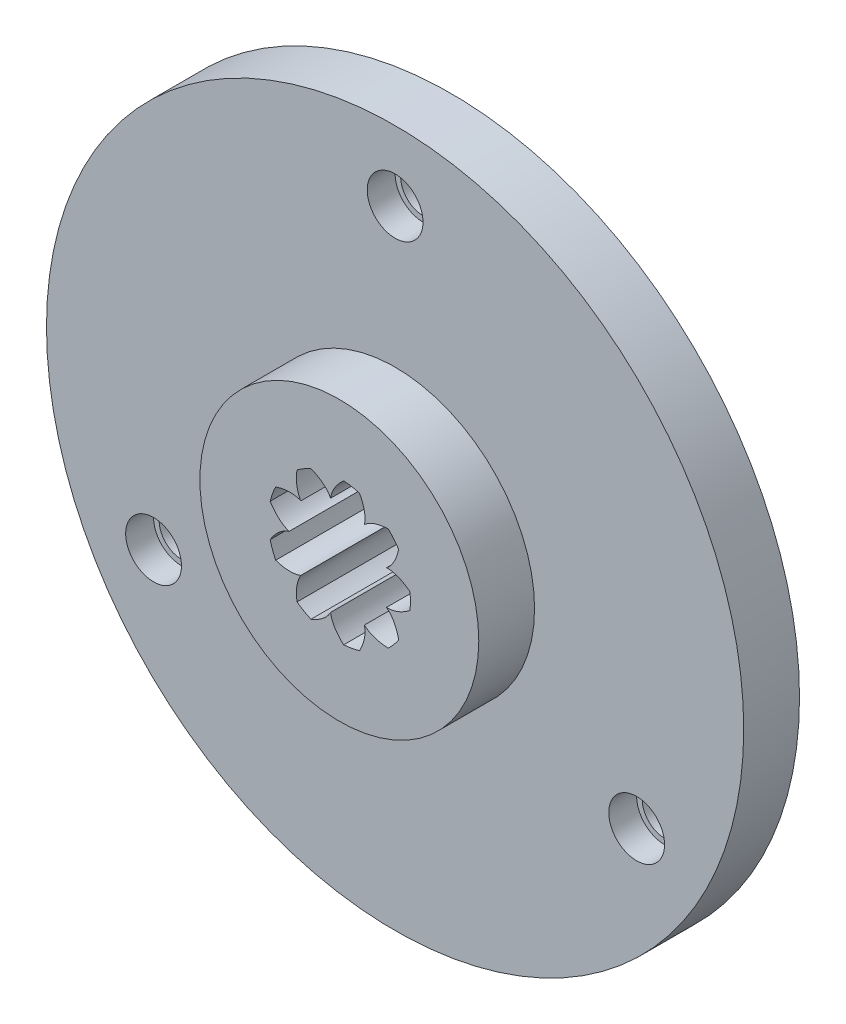
from build123d import *

# Parameters (mm, degrees)
SKETCH_1_R               = 3
SKETCH_1_R_2             = 1.65
EXTRUDE_1_DEPTH          = 4
CUT_EXTRUDE_2_DEPTH      = 6.830951895
PATTERN_CIRCULAR_1_COUNT = 9
SKETCH_2_R               = 5
SKETCH_2_R_2             = 3
EXTRUDE_2_DEPTH          = 4
SKETCH_3_R               = 12.5
SKETCH_3_R_2             = 0.8
SKETCH_3_R_3             = 5
EXTRUDE_4_DEPTH          = 2
CUT_EXTRUDE_START        = 2
SKETCH_3_3_R             = 1
CUT_EXTRUDE_3_DEPTH      = 1


with BuildPart() as part:
    # 草图1 → 凸台-拉伸1 (new body)
    with BuildSketch(Plane.XY):
        Circle(SKETCH_1_R)
        Circle(SKETCH_1_R_2, mode=Mode.SUBTRACT)
    extrude(amount=EXTRUDE_1_DEPTH)

    # 草图1<3> → 切除-拉伸2 (cut, through all)
    with BuildSketch(Plane.XY):
        with BuildLine():
            Line((1.583201231, 0.595370355), (1.54440693, 0.580781573))
            ThreePointArc((1.54440693, 0.580781573), (1.623387112, 0.295151288), (1.65, 0))
            ThreePointArc((1.65, 0), (1.623387112, -0.295151288), (1.54440693, -0.580781573))
            Line((1.54440693, -0.580781573), (1.583201231, -0.595370355))
            add(Edge.make_bspline(
                [(1.583201231, -0.595370355), (1.595268082, -0.599908151), (1.629927649, -0.609960022), (1.698544644, -0.618780808), (1.810680065, -0.617601716), (1.954246735, -0.59352555), (2.132298369, -0.536822163), (2.302941373, -0.452472776), (2.42578745, -0.372108406), (2.505673341, -0.310927028), (2.533645284, -0.288342805)],
                knots=[0, 0, 0, 0, 0, 0.005604068, 0.015718248, 0.029959916, 0.048733667, 0.068727063, 0.096888892, 0.112551479, 0.112551479, 0.112551479, 0.112551479, 0.112551479], degree=4))
            ThreePointArc((2.533645284, -0.288342805), (2.545908038, -0.144403125), (2.55, 0))
            ThreePointArc((2.55, 0), (2.545908038, 0.144403125), (2.533645284, 0.288342805))
            add(Edge.make_bspline(
                [(1.583201231, 0.595370355), (1.595268082, 0.599908151), (1.629927649, 0.609960022), (1.698544644, 0.618780808), (1.810680065, 0.617601716), (1.954246735, 0.59352555), (2.132298369, 0.536822163), (2.302941373, 0.452472776), (2.42578745, 0.372108406), (2.505673341, 0.310927028), (2.533645284, 0.288342805)],
                knots=[0, 0, 0, 0, 0, 0.005604068, 0.015718248, 0.029959916, 0.048733667, 0.068727063, 0.096888892, 0.112551479, 0.112551479, 0.112551479, 0.112551479, 0.112551479], degree=4))
        make_face()
    cut_extrude_2 = extrude(amount=CUT_EXTRUDE_2_DEPTH, mode=Mode.SUBTRACT)

    # 阵列(圆周)1: 切除-拉伸2 ×9 about axis
    pattern_circular_1_axis = Axis((0, 0, 4), (0, 0, 1))
    for i in range(1, PATTERN_CIRCULAR_1_COUNT):
        add(cut_extrude_2.rotate(pattern_circular_1_axis, i * 360 / PATTERN_CIRCULAR_1_COUNT), mode=Mode.SUBTRACT)

    # 草图2 → 凸台-拉伸2 (add)
    with BuildSketch(Plane(origin=(0, 0, 0), x_dir=(-1, 0, 0), z_dir=(0, 0, -1))):
        Circle(SKETCH_2_R)
        Circle(SKETCH_2_R_2, mode=Mode.SUBTRACT)
    extrude(amount=-EXTRUDE_2_DEPTH)

    # 草图3 → 凸台-拉伸4 (add)
    with BuildSketch(Plane.XY):
        Circle(SKETCH_3_R)
        with Locations((0, 10)):
            Circle(SKETCH_3_R_2, mode=Mode.SUBTRACT)
        with Locations((8.660254038, -5)):
            Circle(SKETCH_3_R_2, mode=Mode.SUBTRACT)
        with Locations((-8.660254038, -5)):
            Circle(SKETCH_3_R_2, mode=Mode.SUBTRACT)
        Circle(SKETCH_3_R_3, mode=Mode.SUBTRACT)
    extrude(amount=EXTRUDE_4_DEPTH)

    # 草图3<3> → 切除-拉伸3 (cut)
    with BuildSketch(Plane.XY.offset(CUT_EXTRUDE_START)):
        with Locations((0, 10)):
            Circle(SKETCH_3_3_R)
        with Locations((8.660254038, -5)):
            Circle(SKETCH_3_3_R)
        with Locations((-8.660254038, -5)):
            Circle(SKETCH_3_3_R)
    extrude(amount=-CUT_EXTRUDE_3_DEPTH, mode=Mode.SUBTRACT)


solid = part.part
